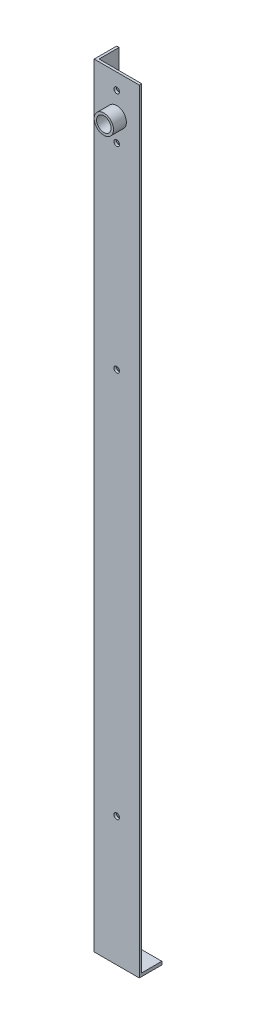
from build123d import *

# Parameters (mm, degrees)
SKETCH1_W           = 88.9
SKETCH1_H           = 44.45
BOSS_EXTRUDE1_DEPTH = 1524
CUT_EXTRUDE1_REACH  = 1527.296
SKETCH2_R           = 7.9375
SKETCH2_R_2         = 5.588
SKETCH4_R           = 19.05
SKETCH4_R_2         = 14.2875
BOSS_EXTRUDE2_DEPTH = 25.4
CUT_EXTRUDE3_REACH  = 1527.392
SKETCH7_W           = 88.9
SKETCH7_H           = 44.45
BOSS_EXTRUDE3_DEPTH = 6.35


with BuildPart() as part:
    # Sketch1 → Boss-Extrude1 (new body)
    with BuildSketch(Plane(origin=(0, 0, 0), x_dir=(1, 0, 0), z_dir=(0, 1, 0))):
        Rectangle(SKETCH1_W, SKETCH1_H)
    extrude(amount=BOSS_EXTRUDE1_DEPTH)

    # Sketch2 → Cut-Extrude1 (cut, up to next)
    with BuildSketch(Plane.XY.offset(22.225), mode=Mode.PRIVATE) as cut_extrude1_sk1:
        with Locations((0, 1447.8)):
            Circle(SKETCH2_R)
    cut_extrude1_tool1 = extrude(cut_extrude1_sk1.sketch, amount=-CUT_EXTRUDE1_REACH, mode=Mode.PRIVATE) & part.part
    # Sketch2 → Cut-Extrude1 (cut, up to next)
    with BuildSketch(Plane.XY.offset(22.225), mode=Mode.PRIVATE) as cut_extrude1_sk2:
        with Locations((0, 1016)):
            Circle(SKETCH2_R_2)
    cut_extrude1_tool2 = extrude(cut_extrude1_sk2.sketch, amount=-CUT_EXTRUDE1_REACH, mode=Mode.PRIVATE) & part.part
    # Sketch2 → Cut-Extrude1 (cut, up to next)
    with BuildSketch(Plane.XY.offset(22.225), mode=Mode.PRIVATE) as cut_extrude1_sk3:
        with Locations((0, 254)):
            Circle(SKETCH2_R_2)
    cut_extrude1_tool3 = extrude(cut_extrude1_sk3.sketch, amount=-CUT_EXTRUDE1_REACH, mode=Mode.PRIVATE) & part.part
    # Sketch2 → Cut-Extrude1 (cut, up to next)
    with BuildSketch(Plane.XY.offset(22.225), mode=Mode.PRIVATE) as cut_extrude1_sk4:
        with Locations((0, 1492.8453125)):
            Circle(SKETCH2_R_2)
    cut_extrude1_tool4 = extrude(cut_extrude1_sk4.sketch, amount=-CUT_EXTRUDE1_REACH, mode=Mode.PRIVATE) & part.part
    # Sketch2 → Cut-Extrude1 (cut, up to next)
    with BuildSketch(Plane.XY.offset(22.225), mode=Mode.PRIVATE) as cut_extrude1_sk5:
        with Locations((0, 1402.7546875)):
            Circle(SKETCH2_R_2)
    cut_extrude1_tool5 = extrude(cut_extrude1_sk5.sketch, amount=-CUT_EXTRUDE1_REACH, mode=Mode.PRIVATE) & part.part
    add(cut_extrude1_tool1.solids().sort_by_distance((0, 1447.8, 22.225))[0], mode=Mode.SUBTRACT)
    add(cut_extrude1_tool2.solids().sort_by_distance((0, 1016, 22.225))[0], mode=Mode.SUBTRACT)
    add(cut_extrude1_tool3.solids().sort_by_distance((0, 254, 22.225))[0], mode=Mode.SUBTRACT)
    add(cut_extrude1_tool4.solids().sort_by_distance((0, 1492.845313, 22.225))[0], mode=Mode.SUBTRACT)
    add(cut_extrude1_tool5.solids().sort_by_distance((0, 1402.754687, 22.225))[0], mode=Mode.SUBTRACT)

    # Sketch4 → Boss-Extrude2 (add)
    with BuildSketch(Plane.XY.offset(22.225)):
        with Locations(Location((0, 1447.8, 0), (0, 0, 180))):
            Circle(SKETCH4_R)
        with Locations((0, 1447.8)):
            Circle(SKETCH4_R_2, mode=Mode.SUBTRACT)
    extrude(amount=BOSS_EXTRUDE2_DEPTH)

    # Sketch5 → Cut-Extrude3 (cut, up to next)
    with BuildSketch(Plane(origin=(0, 1524, 0), x_dir=(1, 0, 0), z_dir=(0, 1, 0)), mode=Mode.PRIVATE) as cut_extrude3_sk1:
        Polygon((-39.6875, 17.4625), (-39.6875, 22.225), (44.45, 22.225), (44.45, -17.4625), (39.6875, -17.4625), (-39.6875, -17.4625), align=None)
    cut_extrude3_tool1 = extrude(cut_extrude3_sk1.sketch, amount=-CUT_EXTRUDE3_REACH, mode=Mode.PRIVATE) & part.part
    add(cut_extrude3_tool1.solids().sort_by_distance((2.38125, 1524, -2.38125))[0], mode=Mode.SUBTRACT)

    # Sketch7 → Boss-Extrude3 (add)
    with BuildSketch(Plane.XZ):
        Rectangle(SKETCH7_W, SKETCH7_H)
    extrude(amount=-BOSS_EXTRUDE3_DEPTH)


solid = part.part
